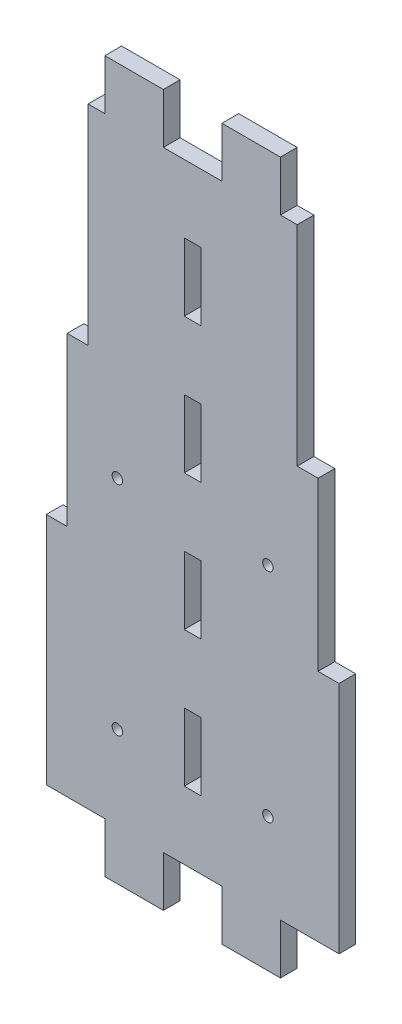
from build123d import *

# Parameters (mm, degrees)
BOSS_EXTRUDE1_DEPTH = 5.08
SKETCH2_R           = 1.5875
CUT_EXTRUDE1_DEPTH  = 220.530070833
SKETCH3_W           = 5.08
SKETCH3_H           = 20.602222222
CUT_EXTRUDE2_DEPTH  = 220.530070833
CUT_EXTRUDE3_DEPTH  = 220.530070833


with BuildPart() as part:
    # Sketch1 → Boss-Extrude1 (new body)
    with BuildSketch(Plane.XY):
        Polygon((0, 0), (17.78, 0), (17.78, 15.24), (35.56, 15.24), (35.56, 0), (53.34, 0), (53.34, 15.24), (71.12, 15.24), (71.12, 0), (88.9, 0), (88.9, -185.42), (71.12, -185.42), (71.12, -200.66), (53.34, -200.66), (53.34, -185.42), (35.56, -185.42), (35.56, -200.66), (17.78, -200.66), (17.78, -185.42), (0, -185.42), align=None)
    extrude(amount=BOSS_EXTRUDE1_DEPTH)

    # Sketch2 → Cut-Extrude1 (cut, through all)
    with BuildSketch(Plane.XY.offset(5.08)):
        with Locations((21.59, -93.98)):
            Circle(SKETCH2_R)
        with Locations((67.31, -93.98)):
            Circle(SKETCH2_R)
        with Locations((67.31, -160.02)):
            Circle(SKETCH2_R)
        with Locations((21.59, -160.02)):
            Circle(SKETCH2_R)
    extrude(amount=-CUT_EXTRUDE1_DEPTH, mode=Mode.SUBTRACT)

    # Sketch3 → Cut-Extrude2 (cut, through all)
    with BuildSketch(Plane(origin=(0, 0, 0), x_dir=(-1, 0, 0), z_dir=(0, 0, -1))):
        with Locations((-44.45, -154.516666667)):
            Rectangle(SKETCH3_W, SKETCH3_H)
        with Locations((-44.45, -72.107777778)):
            Rectangle(SKETCH3_W, SKETCH3_H)
        with Locations((-44.45, -30.903333333)):
            Rectangle(SKETCH3_W, SKETCH3_H)
        with Locations((-44.45, -113.312222222)):
            Rectangle(SKETCH3_W, SKETCH3_H)
    extrude(amount=-CUT_EXTRUDE2_DEPTH, mode=Mode.SUBTRACT)

    # Sketch4 → Cut-Extrude3 (cut, through all)
    with BuildSketch(Plane(origin=(0, 0, 0), x_dir=(-1, 0, 0), z_dir=(0, 0, -1))):
        Polygon((-88.9, 0), (-76.2, 0), (-76.2, -63.5), (-82.55, -63.5), (-82.55, -114.3), (-88.9, -114.3), (-88.9, -63.5), align=None)
        Polygon((-6.35, -63.5), (-12.7, -63.5), (-12.7, 0), (0, 0), (0, -63.5), (0, -114.3), (-6.35, -114.3), align=None)
    extrude(amount=-CUT_EXTRUDE3_DEPTH, mode=Mode.SUBTRACT)


solid = part.part
